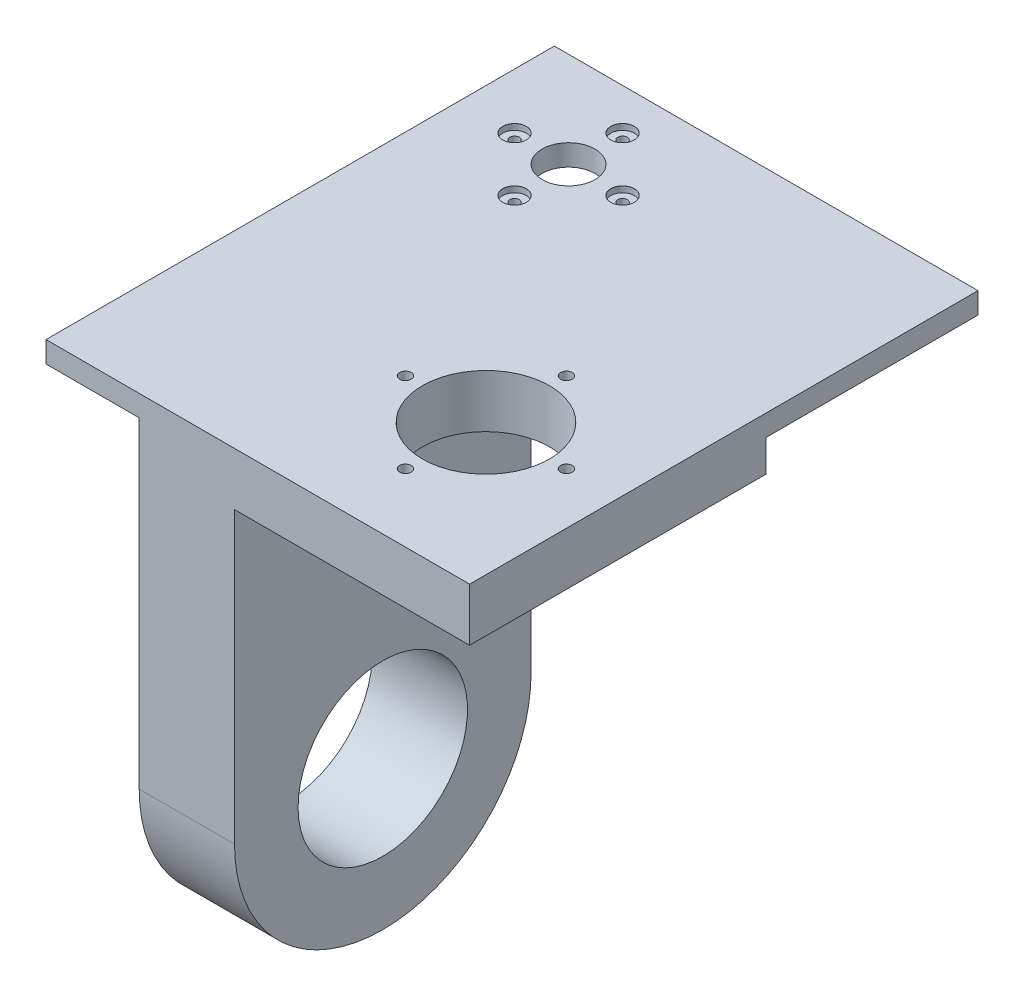
from build123d import *

# Parameters (mm, degrees)
SCHIZZO1_R                                   = 40
ESTRUSIONE_ESTRUSIONE1_DEPTH                 = 45
SCHIZZO2_W                                   = 156
SCHIZZO2_H                                   = 140
SCHIZZO2_R                                   = 30
ESTRUSIONE_ESTRUSIONE2_DEPTH                 = 25
ESTRUSIONE_ESTRUSIONE4_DEPTH                 = 10
SCHIZZO6_R                                   = 12.5
TAGLIO_ESTRUSIONE1_DEPTH                     = 10
FORO_LAMATO_PER_VITE_M4_A_TESTA_ESAG_2_COUNT = 2
FORO_LAMATO_PER_VITE_M4_A_TESTA_ESAG_2_PITCH = 36.062445841
FORO_LAMATO_PER_VITE_M4_A_TESTA_ESAG_3_COUNT = 2
FORO_LAMATO_PER_VITE_M4_A_TESTA_ESAG_3_PITCH = 51
FORO_LAMATO_PER_VITE_M4_A_TESTA_ESAG_4_COUNT = 2
FORO_LAMATO_PER_VITE_M4_A_TESTA_ESAG_4_PITCH = 36.062445841
FORO_PER_VITE_M5_1_D                         = 5.5


with BuildPart() as part:
    # Schizzo1 → Estrusione-Estrusione1 (new body)
    with BuildSketch(Plane(origin=(0, 0, 0), x_dir=(0, 0, -1), z_dir=(1, 0, 0))):
        with BuildLine():
            Line((-70, 0), (-70, 136.8))
            Line((-70, 136.8), (70, 136.8))
            Line((70, 136.8), (70, 0))
            ThreePointArc((70, 0), (0, -70), (-70, 0))
        make_face()
        with Locations(Location((0, 0, 0), (0, 0, 180))):
            Circle(SCHIZZO1_R, mode=Mode.SUBTRACT)
    extrude(amount=ESTRUSIONE_ESTRUSIONE1_DEPTH)

    # Schizzo2 → Estrusione-Estrusione2 (add)
    with BuildSketch(Plane(origin=(0, 136.8, 0), x_dir=(1, 0, 0), z_dir=(0, 1, 0))):
        with Locations((78, 0)):
            Rectangle(SCHIZZO2_W, SCHIZZO2_H)
        with Locations(Location((93.7, 0, 0), (0, 0, 270))):
            Circle(SCHIZZO2_R, mode=Mode.SUBTRACT)
    extrude(amount=ESTRUSIONE_ESTRUSIONE2_DEPTH)

    # Schizzo5 → Estrusione-Estrusione4 (add)
    with BuildSketch(Plane(origin=(0, 161.8, 0), x_dir=(1, 0, 0), z_dir=(0, 1, 0))):
        Polygon((156, 170), (156, 70), (0, 70), (0, -70), (-44, -70), (-44, 170), align=None)
    extrude(amount=-ESTRUSIONE_ESTRUSIONE4_DEPTH)

    # Schizzo6 → Taglio-Estrusione1 (cut)
    with BuildSketch(Plane(origin=(0, 161.8, 0), x_dir=(1, 0, 0), z_dir=(0, 1, 0))):
        with Locations(Location((7.7, 125, 0), (0, 0, 270))):
            Circle(SCHIZZO6_R)
    extrude(amount=-TAGLIO_ESTRUSIONE1_DEPTH, mode=Mode.SUBTRACT)

    # Schizzo8 → Foro lamato per Vite M4 a testa esagonale-1 (revolve, cut)
    with BuildSketch(Plane(origin=(7.7, 161.8, -150.5), x_dir=(0, 0, 1), z_dir=(1, 0, 0))):
        Polygon((0, 0), (0, 231.8), (2.25, 231.8), (2.25, 2.8), (5.5415, 2.8), (5.5415, 0.025), (5.5665, 0), align=None)
    foro_lamato_per_vite_m4_a_testa_esagonal = revolve(axis=Axis((7.7, 168.15, -150.5), (0, -1, 0)), mode=Mode.SUBTRACT)

    # Foro lamato per Vite M4 a testa esag 2: Foro lamato per Vite M4 a testa esagonale-1 ×2
    with Locations(*[Vector(-0.7071067811865476, 0, 0.7071067811865476) * (i * FORO_LAMATO_PER_VITE_M4_A_TESTA_ESAG_2_PITCH) for i in range(1, FORO_LAMATO_PER_VITE_M4_A_TESTA_ESAG_2_COUNT)]):
        add(foro_lamato_per_vite_m4_a_testa_esagonal, mode=Mode.SUBTRACT)

    # Foro lamato per Vite M4 a testa esag 3: Foro lamato per Vite M4 a testa esagonale-1 ×2
    with Locations(*[(0, 0, i * FORO_LAMATO_PER_VITE_M4_A_TESTA_ESAG_3_PITCH) for i in range(1, FORO_LAMATO_PER_VITE_M4_A_TESTA_ESAG_3_COUNT)]):
        add(foro_lamato_per_vite_m4_a_testa_esagonal, mode=Mode.SUBTRACT)

    # Foro lamato per Vite M4 a testa esag 4: Foro lamato per Vite M4 a testa esagonale-1 ×2
    with Locations(*[Vector(0.7071067811865475, 0, 0.7071067811865476) * (i * FORO_LAMATO_PER_VITE_M4_A_TESTA_ESAG_4_PITCH) for i in range(1, FORO_LAMATO_PER_VITE_M4_A_TESTA_ESAG_4_COUNT)]):
        add(foro_lamato_per_vite_m4_a_testa_esagonal, mode=Mode.SUBTRACT)

    # Foro per Vite M5-1 (through all)
    with Locations(Plane(origin=(0, 161.8, 0), x_dir=(1, 0, 0), z_dir=(0, 1, 0))):
        with Locations((93.7, 38), (93.7, -38), (55.7, 0), (131.7, 0)):
            Hole(FORO_PER_VITE_M5_1_D / 2)


solid = part.part
